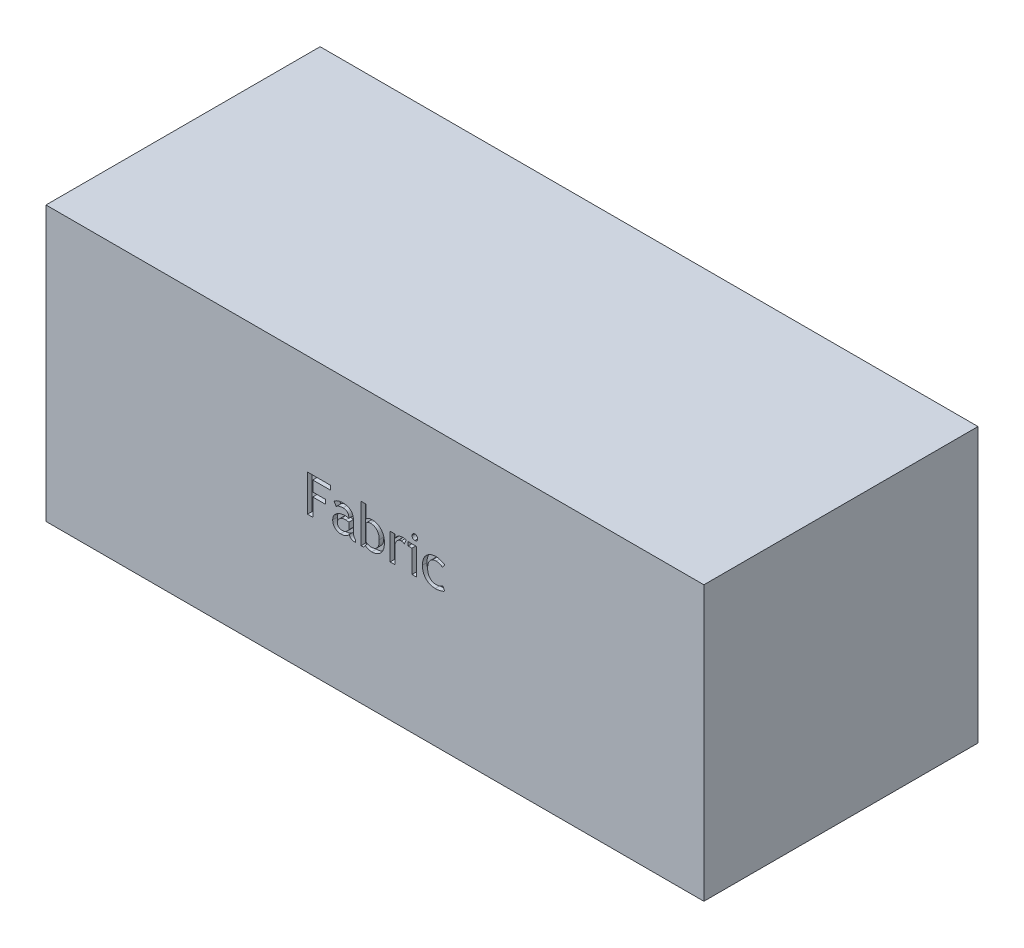
from build123d import *

# Parameters (mm, degrees)
SKETCH1_W           = 1828.8
SKETCH1_H           = 762
BOSS_EXTRUDE1_DEPTH = 762
CUT_EXTRUDE1_DEPTH  = 12.7


with BuildPart() as part:
    # Sketch1 → Boss-Extrude1 (new body)
    with BuildSketch(Plane(origin=(0, 0, 0), x_dir=(1, 0, 0), z_dir=(0, 1, 0))):
        Rectangle(SKETCH1_W, SKETCH1_H)
    extrude(amount=BOSS_EXTRUDE1_DEPTH)

    # Sketch2 → Cut-Extrude1 (cut)
    # profile 1 of 7: a face of its own
    with BuildSketch(Plane.XY.offset(381)):
        Polygon((-172.851948052, 470.724675325), (-172.851948052, 441.696103896), (-137.225974026, 441.696103896), (-137.225974026, 429.820779221), (-172.851948052, 429.820779221), (-172.851948052, 381), (-187.366233766, 381), (-187.366233766, 482.6), (-124.031168831, 482.6), (-124.031168831, 470.724675325), align=None)
    # profile 2 of 7: a face of its own
    with BuildSketch(Plane.XY.offset(381)):
        with BuildLine():
            add(Edge.make_bspline(
                [(-71.313798701, 390.236363636), (-71.999356579, 389.390969175), (-73.36029531, 387.712730031), (-75.788493175, 385.570272111), (-78.451366542, 383.724521622), (-81.399737739, 382.24720517), (-84.603049707, 381.084420221), (-88.069393118, 380.270096435), (-91.799088874, 379.767290863), (-94.375556273, 379.710032664), (-95.703571429, 379.680519481)],
                knots=[0, 0, 0, 0, 0.944960127, 1.875892434, 2.804059133, 3.755402226, 4.734562172, 5.760675535, 6.845761903, 8, 8, 8, 8], degree=3))
            add(Edge.make_bspline(
                [(-95.703571429, 379.680519481), (-96.426488822, 379.698931277), (-97.851615222, 379.735227454), (-99.947622055, 380.065686403), (-101.986358423, 380.545246686), (-103.940328941, 381.281848663), (-105.833762337, 382.184543132), (-107.629311145, 383.318025602), (-109.379198022, 384.613506596), (-111.003657058, 386.132738767), (-112.503941753, 387.792379574), (-113.833149335, 389.56718545), (-114.946129977, 391.450090656), (-115.868814644, 393.428460625), (-116.565162286, 395.512177049), (-117.052550798, 397.689146984), (-117.380126448, 399.957676716), (-117.415619278, 401.505739025), (-117.433766234, 402.29724026)],
                knots=[0, 0, 0, 0, 0.993455545, 1.95845298, 2.911997968, 3.868815737, 4.82409202, 5.79181603, 6.784147119, 7.814064514, 8.844588789, 9.85771863, 10.857760396, 11.847207058, 12.854368548, 13.872291747, 14.912134415, 16, 16, 16, 16], degree=3))
            add(Edge.make_bspline(
                [(-117.433766234, 402.29724026), (-117.399234351, 403.247205575), (-117.331272482, 405.11682322), (-116.877908515, 407.863477775), (-116.075121049, 410.487511837), (-114.992038185, 413.008470584), (-113.557106739, 415.402853971), (-111.845918737, 417.697720435), (-109.808105258, 419.869809881), (-107.479464849, 421.894518554), (-104.932273918, 423.764221485), (-102.159835448, 425.373960211), (-99.235504332, 426.766893377), (-96.119683809, 427.866845909), (-92.858003974, 428.768383511), (-89.413045959, 429.373318152), (-85.802352109, 429.753730633), (-83.334432307, 429.798133891), (-82.075811688, 429.820779221)],
                knots=[0, 0, 0, 0, 0.914144162, 1.799118376, 2.669442492, 3.549088249, 4.432603435, 5.349184236, 6.299014847, 7.292526244, 8.315019686, 9.334664862, 10.373010545, 11.427301971, 12.510180587, 13.625743326, 14.789146875, 16, 16, 16, 16], degree=3))
            add(Edge.make_bspline(
                [(-82.075811688, 429.820779221), (-81.353584182, 429.803730344), (-79.857133077, 429.768405173), (-77.550763028, 429.505277427), (-75.100527502, 429.092013098), (-73.435414551, 428.703097433), (-72.571428571, 428.501298701)],
                knots=[0, 0, 0, 0, 0.901025355, 1.866919186, 2.893197055, 4, 4, 4, 4], degree=3))
            add(Edge.make_bspline(
                [(-72.571428571, 428.501298701), (-72.583123183, 429.195713502), (-72.605746843, 430.539084646), (-72.784731281, 432.492015391), (-73.123651252, 434.300484817), (-73.541597993, 435.99221497), (-74.127380796, 437.53218503), (-74.80372868, 438.959177683), (-75.630273991, 440.239867833), (-76.591509007, 441.382812972), (-77.665049577, 442.411115889), (-78.895479477, 443.263864963), (-80.223923668, 444.028650826), (-81.695346442, 444.607459825), (-83.276970484, 445.09829581), (-84.993803961, 445.409821101), (-86.832659703, 445.628364356), (-88.102096748, 445.645647182), (-88.755681818, 445.654545455)],
                knots=[0, 0, 0, 0, 1.232010569, 2.38337006, 3.473922505, 4.494186629, 5.47029199, 6.391873334, 7.29149648, 8.165725792, 9.03688882, 9.919916482, 10.815232808, 11.75034576, 12.71849901, 13.749128771, 14.841111628, 16, 16, 16, 16], degree=3))
            add(Edge.make_bspline(
                [(-88.755681818, 445.654545455), (-89.759872067, 445.635775608), (-91.718259663, 445.599170358), (-94.565963946, 445.285730327), (-97.237320603, 444.777889311), (-99.729553718, 444.053196163), (-102.048243877, 443.130108785), (-104.184525179, 441.989802365), (-106.14929793, 440.647096738), (-107.308828591, 439.586856482), (-107.888149351, 439.057142857)],
                knots=[0, 0, 0, 0, 1.160376748, 2.26298496, 3.306713365, 4.299604534, 5.258357027, 6.185834306, 7.093612716, 8, 8, 8, 8], degree=3))
            Line((-107.888149351, 439.057142857), (-113.475324675, 449.612987013))
            add(Edge.make_bspline(
                [(-113.475324675, 449.612987013), (-112.799365279, 450.151241085), (-111.382268731, 451.279649081), (-108.925660367, 452.719982014), (-106.131063042, 454.058160886), (-103.049264992, 455.249085549), (-99.822514441, 456.232049855), (-96.59710328, 456.993995848), (-93.434611418, 457.440672792), (-91.347839136, 457.500483766), (-90.322564935, 457.52987013)],
                knots=[0, 0, 0, 0, 0.83233406, 1.744923925, 2.737828223, 3.818310257, 4.927193929, 5.988133053, 7.011528333, 8, 8, 8, 8], degree=3))
            add(Edge.make_bspline(
                [(-90.322564935, 457.52987013), (-89.016025196, 457.506088641), (-86.487348767, 457.460061957), (-82.835041358, 457.109067041), (-79.456886697, 456.536718743), (-76.350025892, 455.74894727), (-73.526391845, 454.689788386), (-70.97389236, 453.41735598), (-68.694188408, 451.901277266), (-66.695930654, 450.126921781), (-64.941043718, 448.108047962), (-63.451674327, 445.801680846), (-62.173665872, 443.245660354), (-61.14290579, 440.407307568), (-60.346033901, 437.299483354), (-59.77446622, 433.920771617), (-59.452408295, 430.266844882), (-59.40249143, 427.745979905), (-59.376623377, 426.43961039)],
                knots=[0, 0, 0, 0, 1.2352911, 2.390781845, 3.465517746, 4.472669273, 5.416533714, 6.311624893, 7.164115709, 7.997342812, 8.831177852, 9.685499483, 10.586398193, 11.528000591, 12.535152118, 13.616293066, 14.7647089, 16, 16, 16, 16], degree=3))
            Line((-59.376623377, 426.43961039), (-59.376623377, 399.472727273))
            add(Edge.make_bspline(
                [(-59.376623377, 399.472727273), (-59.362230718, 398.68170691), (-59.334619389, 397.164188559), (-59.086672541, 394.990529498), (-58.682476091, 393.019937146), (-58.108781251, 391.252497442), (-57.36752466, 389.68676798), (-56.452295648, 388.330413377), (-55.375368535, 387.165442541), (-54.5229557, 386.572857556), (-54.098701299, 386.277922078)],
                knots=[0, 0, 0, 0, 1.279077697, 2.453822896, 3.53296146, 4.527738333, 5.452481132, 6.324974507, 7.166323045, 8, 8, 8, 8], degree=3))
            Line((-54.098701299, 386.277922078), (-54.098701299, 379.680519481))
            add(Edge.make_bspline(
                [(-54.098701299, 379.680519481), (-55.317152527, 379.699511218), (-57.599843447, 379.73509103), (-60.781803541, 380.216572081), (-63.498192443, 380.944885824), (-65.774511887, 382.031701533), (-67.642885213, 383.52115413), (-69.180945898, 385.392931156), (-70.42885025, 387.665802136), (-71.00969156, 389.353005845), (-71.313798701, 390.236363636)],
                knots=[0, 0, 0, 0, 1.322927942, 2.4784214, 3.487862418, 4.369631662, 5.198919122, 6.063344162, 6.986038252, 8, 8, 8, 8], degree=3))
        make_face()
        with BuildLine():
            add(Edge.make_bspline(
                [(-72.571428571, 419.264935065), (-73.539243411, 419.463975843), (-75.319458735, 419.830094885), (-77.760637606, 420.237315236), (-79.732997055, 420.517594636), (-80.893163006, 420.564226438), (-81.395454545, 420.584415584)],
                knots=[0, 0, 0, 0, 1.327096202, 2.441083662, 3.325070274, 4, 4, 4, 4], degree=3))
            add(Edge.make_bspline(
                [(-81.395454545, 420.584415584), (-82.22062381, 420.568594706), (-83.833597361, 420.537669343), (-86.194396214, 420.295794724), (-88.429111323, 419.84788), (-90.563166962, 419.289153687), (-92.567691175, 418.516022334), (-94.464914578, 417.587168638), (-96.22983793, 416.467452743), (-97.88012179, 415.220702948), (-99.350794854, 413.839923583), (-100.662479994, 412.402348598), (-101.759775411, 410.883010247), (-102.679139647, 409.31450051), (-103.380669254, 407.678893076), (-103.886155637, 405.985226983), (-104.175384412, 404.22457312), (-104.217607588, 403.026726419), (-104.238961039, 402.420941558)],
                knots=[0, 0, 0, 0, 1.220287638, 2.385318708, 3.503525747, 4.58834872, 5.643485871, 6.675260618, 7.707335663, 8.72980793, 9.729394515, 10.686538231, 11.60338903, 12.495920083, 13.370033194, 14.228646617, 15.104176635, 16, 16, 16, 16], degree=3))
            add(Edge.make_bspline(
                [(-104.238961039, 402.420941558), (-104.208896762, 401.461000685), (-104.152039971, 399.645585057), (-103.477093201, 397.119705818), (-102.396810864, 394.960908326), (-100.839830593, 393.19826576), (-98.84338141, 391.830451172), (-96.408152165, 390.898407439), (-93.565942628, 390.318332195), (-91.528374711, 390.264795711), (-90.446266234, 390.236363636)],
                knots=[0, 0, 0, 0, 1.090937083, 2.063152309, 2.952441297, 3.817735852, 4.712383707, 5.68197955, 6.768949218, 8, 8, 8, 8], degree=3))
            add(Edge.make_bspline(
                [(-90.446266234, 390.236363636), (-89.612155102, 390.26722146), (-87.956506661, 390.328471941), (-85.515352886, 390.848664269), (-83.150148572, 391.674696447), (-80.865017164, 392.844750781), (-78.664841553, 394.350764384), (-76.538394702, 396.183496931), (-74.464105592, 398.329742072), (-73.215448529, 399.954306211), (-72.571428571, 400.792207792)],
                knots=[0, 0, 0, 0, 0.926994493, 1.840014991, 2.763567446, 3.707150477, 4.686710869, 5.722325487, 6.825243626, 8, 8, 8, 8], degree=3))
            Line((-72.571428571, 400.792207792), (-72.571428571, 419.264935065))
        make_face(mode=Mode.SUBTRACT)
    # profile 3 of 7: a face of its own
    with BuildSketch(Plane.XY.offset(381)):
        with BuildLine():
            Line((-27.008116883, 386.42224026), (-31.667532468, 379.680519481))
            Line((-31.667532468, 379.680519481), (-38.264935065, 379.680519481))
            Line((-38.264935065, 379.680519481), (-38.264935065, 486.558441558))
            Line((-38.264935065, 486.558441558), (-25.07012987, 486.558441558))
            Line((-25.07012987, 486.558441558), (-25.07012987, 450.643831169))
            add(Edge.make_bspline(
                [(-25.07012987, 450.643831169), (-24.698417078, 451.076412261), (-23.898348878, 452.007492343), (-22.302982449, 453.2174458), (-20.312605149, 454.354523105), (-17.989379866, 455.411477247), (-15.487073572, 456.343399601), (-12.928091677, 457.031442108), (-10.383099279, 457.435208419), (-8.694812223, 457.498425158), (-7.855032468, 457.52987013)],
                knots=[0, 0, 0, 0, 0.717580567, 1.544508033, 2.507609923, 3.604907787, 4.759138542, 5.871086499, 6.941045923, 8, 8, 8, 8], degree=3))
            add(Edge.make_bspline(
                [(-7.855032468, 457.52987013), (-6.609631961, 457.498914735), (-4.170456841, 457.438287148), (-0.601621528, 456.941547977), (2.776306934, 456.080912627), (5.992083469, 454.944734516), (9.004746684, 453.412979206), (11.84393664, 451.566682588), (14.515923543, 449.400094535), (16.950680693, 446.895933112), (19.177532767, 444.175547743), (21.095275663, 441.229363701), (22.736467313, 438.119089998), (24.084436581, 434.828092039), (25.108084602, 431.350204809), (25.845405859, 427.708294002), (26.317073271, 423.895477632), (26.365100693, 421.293678033), (26.38961039, 419.965909091)],
                knots=[0, 0, 0, 0, 1.04831751, 2.053178856, 3.025701447, 3.979295096, 4.918615472, 5.863904809, 6.826322636, 7.80830072, 8.799627229, 9.781792812, 10.762730476, 11.756637229, 12.770850643, 13.810300186, 14.882536762, 16, 16, 16, 16], degree=3))
            add(Edge.make_bspline(
                [(26.38961039, 419.965909091), (26.365687399, 418.438981452), (26.319129131, 415.467316761), (25.8481785, 411.133445436), (25.119939663, 407.050342754), (24.09265827, 403.209496159), (22.750939249, 399.623560716), (21.10136478, 396.292029029), (19.142826172, 393.217398738), (16.929739507, 390.395287368), (14.447863925, 387.870694803), (11.74085772, 385.67049353), (8.802494674, 383.830773176), (5.680388603, 382.289778282), (2.336870046, 381.109745806), (-1.220316425, 380.301639721), (-4.979727941, 379.7623011), (-7.564440835, 379.708185903), (-8.885876623, 379.680519481)],
                knots=[0, 0, 0, 0, 1.210271703, 2.355397593, 3.451980894, 4.496208135, 5.503220732, 6.482838178, 7.438195966, 8.388771209, 9.321229286, 10.239456896, 11.148013806, 12.064299239, 12.994940558, 13.95186653, 14.952890717, 16, 16, 16, 16], degree=3))
            add(Edge.make_bspline(
                [(-8.885876623, 379.680519481), (-9.759916034, 379.704690663), (-11.515746542, 379.753247397), (-14.132399378, 380.13678211), (-16.733182576, 380.760577806), (-19.251989813, 381.616355053), (-21.622723851, 382.615788928), (-23.705706657, 383.786507686), (-25.5357808, 384.990701874), (-26.53284711, 385.960139974), (-27.008116883, 386.42224026)],
                knots=[0, 0, 0, 0, 1.059983697, 2.129368185, 3.201089987, 4.300472019, 5.35358107, 6.316390659, 7.197477016, 8, 8, 8, 8], degree=3))
        make_face()
        with BuildLine():
            Line((-25.07012987, 440.953896104), (-25.07012987, 396.627597403))
            add(Edge.make_bspline(
                [(-25.07012987, 396.627597403), (-25.049110419, 396.521810183), (-25.000674923, 396.278042814), (-24.735227714, 395.926359265), (-24.367460121, 395.509323078), (-23.820292885, 395.067916748), (-23.138931522, 394.574055315), (-22.307903141, 394.033916477), (-21.313721236, 393.468305669), (-19.863434122, 392.64053286), (-18.07943042, 391.727876072), (-16.079438942, 390.914767486), (-14.378035368, 390.364520745), (-13.314511145, 390.275652869), (-12.844318182, 390.236363636)],
                knots=[0, 0, 0, 0, 0.27125546, 0.625058774, 1.095211817, 1.690324166, 2.403303738, 3.236900649, 4.207876913, 5.31103719, 7.483401061, 9.293954903, 10.803634807, 12, 12, 12, 12], degree=3))
            add(Edge.make_bspline(
                [(-12.844318182, 390.236363636), (-11.778262645, 390.254610657), (-9.716966041, 390.289892611), (-6.745947613, 390.60270146), (-4.000900773, 391.102473201), (-1.505608089, 391.851440542), (0.776856426, 392.768136861), (2.80170956, 393.937983747), (4.627113247, 395.274427448), (6.197794992, 396.87477315), (7.544299216, 398.72426884), (8.74268038, 400.822823115), (9.676805773, 403.239383043), (10.520789687, 405.896952441), (11.115821861, 408.850523668), (11.570771799, 412.071400876), (11.836534548, 415.583815712), (11.8620694, 418.020602927), (11.875324675, 419.285551948)],
                knots=[0, 0, 0, 0, 1.154392694, 2.232102981, 3.232155025, 4.171876855, 5.049680019, 5.889876278, 6.69827681, 7.493094459, 8.307470453, 9.17076137, 10.102429477, 11.10778658, 12.188141496, 13.360868479, 14.630012989, 16, 16, 16, 16], degree=3))
            add(Edge.make_bspline(
                [(11.875324675, 419.285551948), (11.856060906, 420.34455456), (11.818571981, 422.405463211), (11.512341408, 425.413641798), (10.968916648, 428.236265879), (10.263435539, 430.89507632), (9.308035641, 433.358669061), (8.14656943, 435.644530095), (6.784994889, 437.757080026), (5.215931578, 439.68093878), (3.46234694, 441.38255089), (1.574033402, 442.893117241), (-0.475763754, 444.143808688), (-2.661936943, 445.19215731), (-5.002514014, 445.98958464), (-7.487285304, 446.572246), (-10.121273671, 446.895518552), (-11.922594798, 446.947451995), (-12.844318182, 446.974025974)],
                knots=[0, 0, 0, 0, 1.210298462, 2.355343171, 3.450678136, 4.493020343, 5.495164409, 6.464732824, 7.419035532, 8.362446429, 9.29563204, 10.207109968, 11.120515091, 12.034021533, 12.973007478, 13.940919925, 14.946383172, 16, 16, 16, 16], degree=3))
            add(Edge.make_bspline(
                [(-12.844318182, 446.974025974), (-13.286011618, 446.938047429), (-14.258500312, 446.858832468), (-15.818156167, 446.437163562), (-17.593701238, 445.733794099), (-19.504798117, 444.831788517), (-21.354493622, 443.828915537), (-22.942286551, 442.855970658), (-24.186133905, 441.939483558), (-24.796917903, 441.258506416), (-25.07012987, 440.953896104)],
                knots=[0, 0, 0, 0, 0.765733672, 1.685937072, 2.781510274, 4.069105279, 5.341059667, 6.420241275, 7.293352495, 8, 8, 8, 8], degree=3))
        make_face(mode=Mode.SUBTRACT)
    # profile 4 of 7: a face of its own
    with BuildSketch(Plane.XY.offset(381)):
        with BuildLine():
            add(Edge.make_bspline(
                [(81.601623377, 443.984577922), (80.890739921, 444.436825565), (79.514347576, 445.3124546), (77.333061613, 446.272302654), (75.131746502, 446.864537515), (73.6538599, 446.937761003), (72.921915584, 446.974025974)],
                knots=[0, 0, 0, 0, 1.083912525, 2.09864063, 3.058324786, 4, 4, 4, 4], degree=3))
            add(Edge.make_bspline(
                [(72.921915584, 446.974025974), (72.343238144, 446.954702119), (71.198065572, 446.916461213), (69.514242121, 446.595839065), (67.888062861, 446.074458614), (66.316550329, 445.348094121), (64.794179089, 444.414795684), (63.358982145, 443.239099042), (61.944844102, 441.900797622), (60.627128315, 440.357628343), (59.384933067, 438.693052931), (58.352876856, 436.884259357), (57.416421769, 435.026728353), (56.717358703, 433.058948912), (56.12178953, 431.025433519), (55.719184938, 428.898920512), (55.463316502, 426.68642947), (55.433381865, 425.18270756), (55.418181818, 424.419155844)],
                knots=[0, 0, 0, 0, 0.879821936, 1.741121875, 2.597521335, 3.47235911, 4.368980926, 5.306256831, 6.289802627, 7.327487782, 8.389847235, 9.44425347, 10.491690238, 11.550235473, 12.6158827, 13.712920077, 14.838679022, 16, 16, 16, 16], degree=3))
            Line((55.418181818, 424.419155844), (55.418181818, 381))
            Line((55.418181818, 381), (42.223376623, 381))
            Line((42.223376623, 381), (42.223376623, 454.890909091))
            Line((42.223376623, 454.890909091), (55.418181818, 454.890909091))
            Line((55.418181818, 454.890909091), (55.418181818, 444.335064935))
            add(Edge.make_bspline(
                [(55.418181818, 444.335064935), (56.032992444, 445.381923602), (57.225575364, 447.412574527), (59.371444319, 450.118459497), (61.735448968, 452.41612363), (64.338613602, 454.295158581), (67.169097047, 455.749881333), (70.21752211, 456.785980772), (73.479980332, 457.418514239), (75.729800028, 457.492191567), (76.880357143, 457.52987013)],
                knots=[0, 0, 0, 0, 1.095181229, 2.124384928, 3.107413611, 4.063213658, 5.012363421, 5.969994755, 6.961855929, 8, 8, 8, 8], degree=3))
            add(Edge.make_bspline(
                [(76.880357143, 457.52987013), (77.533463693, 457.507485588), (78.979453805, 457.457925795), (81.342510756, 457.253763728), (84.086898322, 456.835075703), (86.041618462, 456.508518462), (87.085714286, 456.334090909)],
                knots=[0, 0, 0, 0, 0.762334318, 1.687822431, 2.764971572, 4, 4, 4, 4], degree=3))
            Line((87.085714286, 456.334090909), (81.601623377, 443.984577922))
        make_face()
    # profile 5 of 7: a face of its own
    with BuildSketch(Plane.XY.offset(381)):
        with BuildLine():
            add(Edge.make_bspline(
                [(110.79512987, 482.6), (111.326975477, 482.572601865), (112.374725071, 482.518626832), (113.88718071, 482.079604783), (115.246805887, 481.308698573), (116.459197791, 480.30574867), (117.456022364, 479.096924203), (118.22846517, 477.761323726), (118.674496966, 476.277638117), (118.726620093, 475.249543904), (118.753246753, 474.724350649)],
                knots=[0, 0, 0, 0, 1.026037921, 2.021321229, 3.007360769, 4.025126835, 5.042892902, 6.017344784, 6.987177311, 8, 8, 8, 8], degree=3))
            add(Edge.make_bspline(
                [(118.753246753, 474.724350649), (118.725768661, 474.192563342), (118.671636109, 473.1449286), (118.233764781, 471.631633934), (117.455858713, 470.270548705), (116.465255251, 469.042526418), (115.252012088, 468.033471229), (113.881097324, 467.291151438), (112.375477135, 466.846185691), (111.327228695, 466.793153372), (110.79512987, 466.766233766)],
                knots=[0, 0, 0, 0, 1.019141304, 2.007734713, 2.987146489, 4.008246453, 5.019171502, 5.992265287, 6.980858696, 8, 8, 8, 8], degree=3))
            add(Edge.make_bspline(
                [(110.79512987, 466.766233766), (110.269510881, 466.792077692), (109.240583269, 466.842668575), (107.760342579, 467.300644063), (106.399420188, 468.032359067), (105.188613258, 469.043693996), (104.192068477, 470.264489239), (103.443651904, 471.637928112), (102.999627024, 473.144122039), (102.94646564, 474.192291775), (102.919480519, 474.724350649)],
                knots=[0, 0, 0, 0, 1.011670657, 1.980400051, 2.958964513, 3.975572925, 5.002413455, 5.980977917, 6.975129142, 8, 8, 8, 8], degree=3))
            add(Edge.make_bspline(
                [(102.919480519, 474.724350649), (102.945356993, 475.256819979), (102.9960132, 476.299190653), (103.448859642, 477.784501325), (104.167201014, 479.150727035), (105.17709344, 480.342387079), (106.368753484, 481.352279505), (107.734979194, 482.070620877), (109.220289867, 482.523467319), (110.262660541, 482.574123527), (110.79512987, 482.6)],
                knots=[0, 0, 0, 0, 1.029106498, 2.014595724, 2.979190096, 4, 5.020809904, 5.985404276, 6.970893502, 8, 8, 8, 8], degree=3))
        make_face()
    # profile 6 of 7: a face of its own
    with BuildSketch(Plane.XY.offset(381)):
        Polygon((102.919480519, 381), (102.919480519, 444.335064935), (92.363636364, 444.335064935), (92.363636364, 454.890909091), (116.114285714, 454.890909091), (116.114285714, 381), align=None)
    # profile 7 of 7: a face of its own
    with BuildSketch(Plane.XY.offset(381)):
        with BuildLine():
            Line((193.963636364, 449.612987013), (187.386850649, 440.376623377))
            add(Edge.make_bspline(
                [(187.386850649, 440.376623377), (186.993329225, 440.782199051), (186.141986284, 441.659620119), (184.493299594, 442.764443361), (182.491515842, 443.863035014), (180.171066134, 444.887103451), (177.674847877, 445.817655886), (175.115456294, 446.460903689), (172.586105072, 446.912428962), (170.902127523, 446.95363278), (170.068668831, 446.974025974)],
                knots=[0, 0, 0, 0, 0.714129473, 1.544945328, 2.499524529, 3.606123095, 4.754426172, 5.869211769, 6.945399259, 8, 8, 8, 8], degree=3))
            add(Edge.make_bspline(
                [(170.068668831, 446.974025974), (169.187531146, 446.951764297), (167.458398539, 446.908078284), (164.938961775, 446.521229758), (162.555044801, 445.938297392), (160.312444685, 445.077014017), (158.216660402, 443.966970642), (156.262715347, 442.612171724), (154.446477981, 441.026150136), (152.787156821, 439.199166577), (151.310437374, 437.150398962), (149.9958223, 434.935689491), (148.909325025, 432.524145276), (147.99675556, 429.940080827), (147.300316484, 427.164836455), (146.811816176, 424.213666668), (146.522886954, 421.084984953), (146.482881404, 418.942555432), (146.462337662, 417.84237013)],
                knots=[0, 0, 0, 0, 0.999237626, 1.960890323, 2.885732248, 3.779273414, 4.679256432, 5.570446663, 6.471273863, 7.409692175, 8.364268318, 9.332537753, 10.32704794, 11.360420259, 12.438461241, 13.569168563, 14.751713886, 16, 16, 16, 16], degree=3))
            add(Edge.make_bspline(
                [(146.462337662, 417.84237013), (146.480276089, 416.748805206), (146.51510136, 414.625782054), (146.836339636, 411.547414842), (147.315972743, 408.669254341), (148.019711282, 405.991454052), (148.921763015, 403.509137919), (150.035020809, 401.223508635), (151.369908819, 399.152247383), (152.86659904, 397.262590002), (154.576785569, 395.610083203), (156.426781606, 394.156481475), (158.457031882, 392.953760005), (160.634768781, 391.961136989), (162.969248079, 391.176308391), (165.456820249, 390.624937115), (168.093791225, 390.286478577), (169.90268034, 390.253366003), (170.831493506, 390.236363636)],
                knots=[0, 0, 0, 0, 1.252959939, 2.432469166, 3.543482404, 4.594231037, 5.600926928, 6.566094148, 7.501227139, 8.420098036, 9.322413799, 10.220456753, 11.110624572, 12.019960222, 12.958966101, 13.927758104, 14.935962662, 16, 16, 16, 16], degree=3))
            add(Edge.make_bspline(
                [(170.831493506, 390.236363636), (171.574741754, 390.256380593), (173.067569807, 390.296585026), (175.303462728, 390.61954166), (177.543646703, 391.140177404), (179.78701192, 391.858964953), (182.029659999, 392.801410233), (184.278759947, 393.943508858), (186.548212199, 395.271475774), (188.005963377, 396.306976229), (188.747564935, 396.833766234)],
                knots=[0, 0, 0, 0, 0.918512099, 1.844848789, 2.786639656, 3.75923298, 4.753223091, 5.790457131, 6.875939558, 8, 8, 8, 8], degree=3))
            Line((188.747564935, 396.833766234), (193.963636364, 386.277922078))
            add(Edge.make_bspline(
                [(193.963636364, 386.277922078), (193.051190722, 385.746535824), (191.210798687, 384.674736053), (188.264920297, 383.34542014), (185.170230379, 382.211703783), (181.917940288, 381.281916999), (178.507410572, 380.562382871), (174.932994041, 380.052682398), (171.20142222, 379.737255807), (168.660480426, 379.699650158), (167.367857143, 379.680519481)],
                knots=[0, 0, 0, 0, 0.912713853, 1.840933016, 2.79052362, 3.761251731, 4.763775478, 5.802708547, 6.882197894, 8, 8, 8, 8], degree=3))
            add(Edge.make_bspline(
                [(167.367857143, 379.680519481), (166.115600834, 379.712785521), (163.656883506, 379.776137626), (160.051627823, 380.257585569), (156.609629948, 381.057067261), (153.338725593, 382.201338303), (150.222579412, 383.645414335), (147.286074444, 385.434097149), (144.505756143, 387.528607117), (141.9128971, 389.931838858), (139.577741127, 392.625601601), (137.507326861, 395.547589513), (135.803798659, 398.721383221), (134.393280216, 402.113218237), (133.275663715, 405.727789859), (132.501094193, 409.574962347), (132.046885105, 413.646216993), (131.98158285, 416.432372976), (131.948051948, 417.862987013)],
                knots=[0, 0, 0, 0, 1.025697672, 2.013885354, 2.973956964, 3.915895403, 4.847870077, 5.782561884, 6.72732302, 7.69541756, 8.673156467, 9.643164676, 10.623186641, 11.617578138, 12.648716234, 13.717577208, 14.828039025, 16, 16, 16, 16], degree=3))
            add(Edge.make_bspline(
                [(131.948051948, 417.862987013), (131.978697504, 419.321280238), (132.038727533, 422.177856998), (132.537776507, 426.346008829), (133.368677038, 430.289157614), (134.491230262, 434.027411412), (135.982643775, 437.532053468), (137.785805829, 440.829627469), (139.942465291, 443.881925995), (142.397093324, 446.711023626), (145.128246774, 449.270827428), (148.135341066, 451.484354292), (151.384508591, 453.361075033), (154.876553855, 454.872809526), (158.599849566, 456.090491842), (162.569689729, 456.911016205), (166.775851223, 457.448339786), (169.661452742, 457.502238919), (171.140746753, 457.52987013)],
                knots=[0, 0, 0, 0, 1.110701233, 2.175696407, 3.192233128, 4.177621257, 5.144178712, 6.088488417, 7.035508184, 7.985562121, 8.937561489, 9.881014532, 10.823915415, 11.789806225, 12.774916153, 13.802781966, 14.873603491, 16, 16, 16, 16], degree=3))
            add(Edge.make_bspline(
                [(171.140746753, 457.52987013), (172.138726101, 457.493925532), (174.193165277, 457.419930021), (177.331661308, 456.932704207), (180.579103881, 456.086643196), (183.842813766, 454.974947963), (186.950607013, 453.712259137), (189.714313009, 452.41006897), (192.042621943, 451.085169378), (193.354282485, 450.07996947), (193.963636364, 449.612987013)],
                knots=[0, 0, 0, 0, 0.977055502, 2.011365371, 3.101418391, 4.258843969, 5.384546701, 6.383661135, 7.249102703, 8, 8, 8, 8], degree=3))
        make_face()
    extrude(amount=-CUT_EXTRUDE1_DEPTH, mode=Mode.SUBTRACT)


solid = part.part
